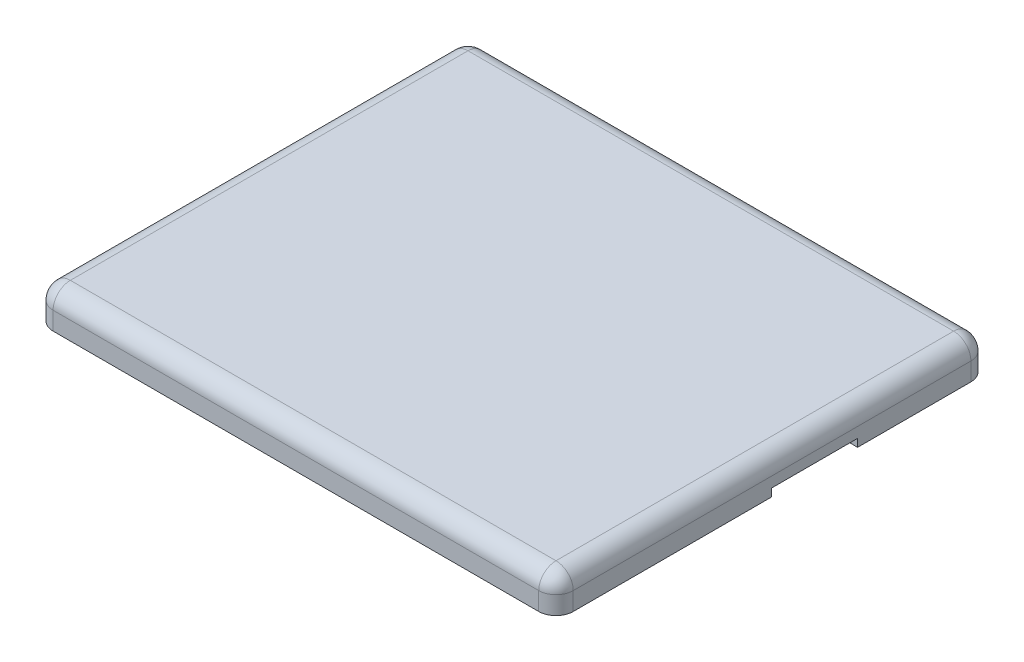
from build123d import *

# Parameters (mm, degrees)
SKETCH1_W          = 60.3
SKETCH1_H          = 50.1
OUTERWALLS_DEPTH   = 2
SKETCH2_W          = 60.3
SKETCH2_H          = 50.1
SKETCH2_W_2        = 57.9
SKETCH2_H_2        = 47.7
INNER_DEPTH        = 2.1
SKETCH4_W          = 10
SKETCH4_H          = 3.7
CUT_EXTRUDE1_DEPTH = 20
FILLET1_R          = 2


with BuildPart() as part:
    # Sketch1 → OuterWalls (new body)
    with BuildSketch(Plane(origin=(0, 0, 0), x_dir=(1, 0, 0), z_dir=(0, 1, 0))):
        Rectangle(SKETCH1_W, SKETCH1_H)
    extrude(amount=-OUTERWALLS_DEPTH)

    # Sketch2 → Inner (add)
    with BuildSketch(Plane(origin=(0, -2, 0), x_dir=(-1, 0, 0), z_dir=(0, -1, 0))):
        Rectangle(SKETCH2_W, SKETCH2_H)
        Rectangle(SKETCH2_W_2, SKETCH2_H_2, mode=Mode.SUBTRACT)
    extrude(amount=INNER_DEPTH)

    # Sketch4 → Cut-Extrude1 (cut)
    with BuildSketch(Plane(origin=(30.15, 0, 0), x_dir=(0, 0, -1), z_dir=(1, 0, 0))):
        with Locations((4.91675286, -5.05)):
            Rectangle(SKETCH4_W, SKETCH4_H)
    extrude(amount=-CUT_EXTRUDE1_DEPTH, mode=Mode.SUBTRACT)

    # Fillet1
    fillet1_edges = [part.edges().sort_by_distance(p)[0] for p in [
        (0, 0, -25.05),
        (30.15, 0, 0),
        (0, 0, 25.05),
        (-30.15, 0, 0),
        (-30.15, -2.05, -25.05),
        (30.15, -2.05, -25.05),
        (30.15, -2.05, 25.05),
        (-30.15, -2.05, 25.05),
    ]]
    fillet(fillet1_edges, radius=FILLET1_R)


solid = part.part
